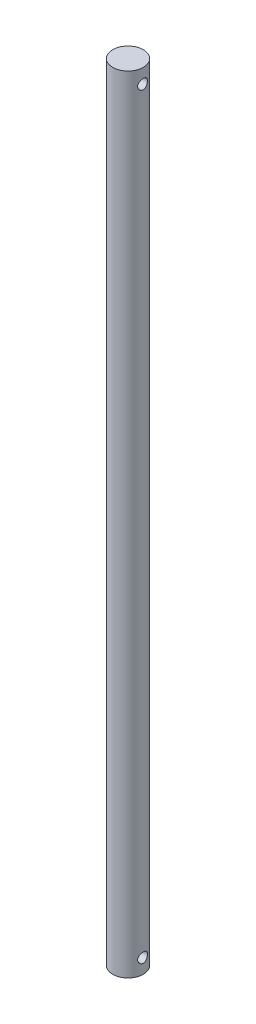
from build123d import *

# Parameters (mm, degrees)
SKETCH1_R           = 9.906
BOSS_EXTRUDE1_DEPTH = 508
CUT_EXTRUDE1_START  = 20.32
SKETCH2_R           = 3.175
CUT_EXTRUDE1_DEPTH  = 22.86
SCALE1_SCALE        = 0.25


with BuildPart() as part:
    # Sketch1 → Boss-Extrude1 (new body)
    with BuildSketch(Plane(origin=(0, 0, 0), x_dir=(1, 0, 0), z_dir=(0, 1, 0))):
        with Locations(Location((0, 0, 0), (0, 0, 270))):
            Circle(SKETCH1_R)
    extrude(amount=BOSS_EXTRUDE1_DEPTH)

    # Sketch2 → Cut-Extrude1 (cut)
    with BuildSketch(Plane(origin=(0, 0, 0), x_dir=(0, 0, -1), z_dir=(1, 0, 0)).offset(CUT_EXTRUDE1_START)):
        with Locations((0, 498.602)):
            Circle(SKETCH2_R)
    cut_extrude1 = extrude(amount=-CUT_EXTRUDE1_DEPTH, mode=Mode.SUBTRACT)

    # Mirror1: Cut-Extrude1 across plane
    add(cut_extrude1.mirror(Plane.ZX.offset(254)), mode=Mode.SUBTRACT)


with BuildPart() as part_1:
    # Scale1: scaled about (-0.018116733, 254, 1.117e-06)
    add(part.part.scale(SCALE1_SCALE).moved(Location((-0.01358755, 190.5, 8.38e-07))))


solid = part_1.part
